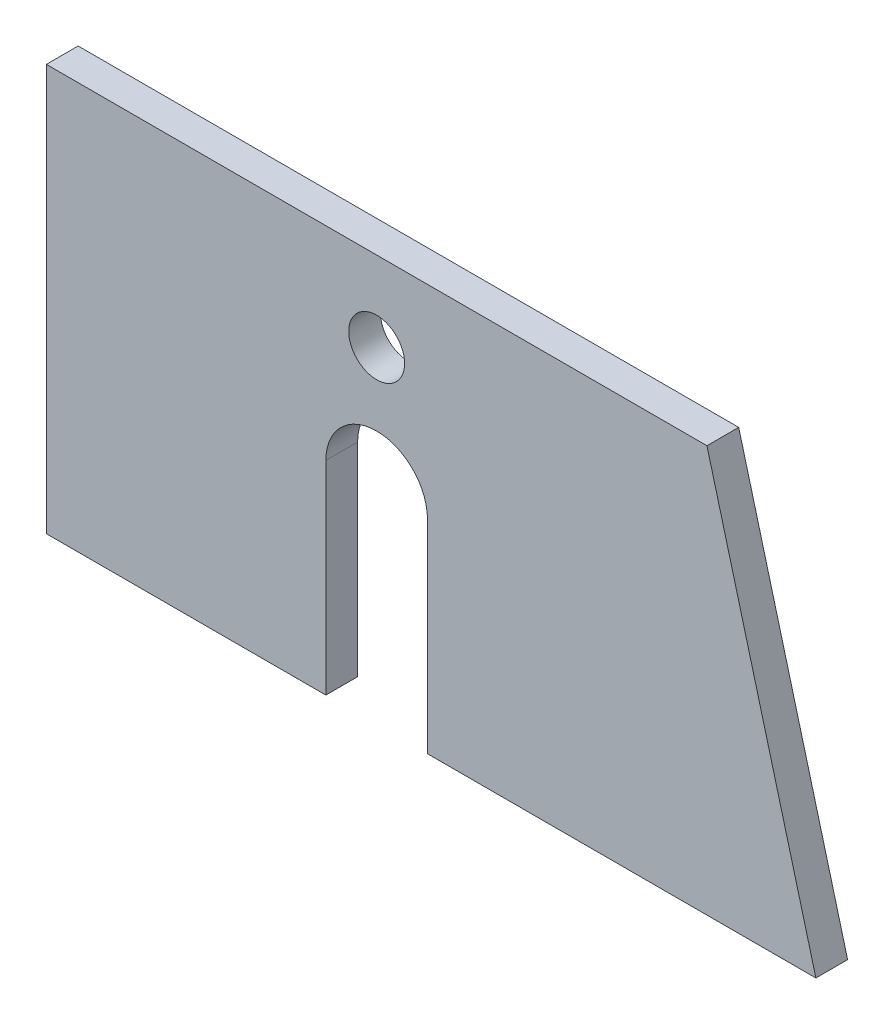
from build123d import *

# Parameters (mm, degrees)
SKETCH1_R           = 2.75
BOSS_EXTRUDE1_DEPTH = 3.125


with BuildPart() as part:
    # Sketch1 → Boss-Extrude1 (new body)
    with BuildSketch(Plane.XY):
        with BuildLine():
            Line((-32.5, 20), (32.5, 20))
            Line((32.5, 20), (43.217967697, -20))
            Line((43.217967697, -20), (5, -20))
            Line((5, -20), (5, 0))
            ThreePointArc((5, 0), (0, 5), (-5, 0))
            Line((-5, 0), (-5, -20))
            Line((-5, -20), (-32.5, -20))
            Line((-32.5, -20), (-32.5, 20))
        make_face()
        with Locations((0, 12.125)):
            Circle(SKETCH1_R, mode=Mode.SUBTRACT)
    extrude(amount=BOSS_EXTRUDE1_DEPTH)


solid = part.part
